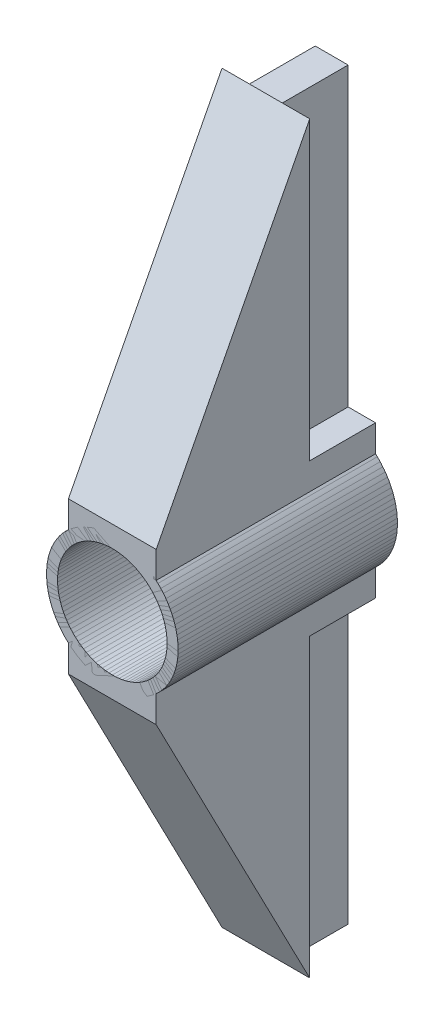
from build123d import *

# Parameters (mm, degrees)
SKETCH1_R             = 6
SKETCH1_R_2           = 5
BOSS_EXTRUDE1_DEPTH   = 20
BOSS_EXTRUDE2_DEPTH   = 4
SKETCH3_W             = 2.5
SKETCH3_H             = 6
CUT_EXTRUDE1_DEPTH    = 27.000002
BODY_MOVE_COPY1_ANGLE = 180
SKETCH4_R             = 5
CUT_EXTRUDE2_DEPTH    = 40.831531803


with BuildPart() as part:
    # Sketch1 → Boss-Extrude1 (new body)
    with BuildSketch(Plane.XY):
        Circle(SKETCH1_R)
        Circle(SKETCH1_R_2, mode=Mode.SUBTRACT)
    extrude(amount=BOSS_EXTRUDE1_DEPTH)

    # Sketch2 → Boss-Extrude2 (add, symmetric)
    with BuildSketch(Plane(origin=(0, 0, 0), x_dir=(0, 0, -1), z_dir=(1, 0, 0))):
        Polygon((-20, 6.9197719), (-20, 3.9197719), (0, 3.9197719), (0, 33.9197719), (-6, 33.9197719), align=None)
    extrude(amount=BOSS_EXTRUDE2_DEPTH, both=True)

    # Sketch3 → Cut-Extrude1 (cut)
    with BuildSketch(Plane(origin=(0, 33.9197719, 0), x_dir=(1, 0, 0), z_dir=(0, 1, 0))):
        with Locations((-2.75, -3)):
            Rectangle(SKETCH3_W, SKETCH3_H)
        with Locations((2.75, -3)):
            Rectangle(SKETCH3_W, SKETCH3_H)
    extrude(amount=-CUT_EXTRUDE1_DEPTH, mode=Mode.SUBTRACT)


with BuildPart() as body_2:
    # Body-Move/Copy1: copy of part
    add(part.part.rotate(Axis((0, 0, 0), (0, 0, 1)), BODY_MOVE_COPY1_ANGLE))


with BuildPart() as cut_extrude2_tool:
    # Sketch4 → Cut-Extrude2 (new, through all)
    with BuildSketch(Plane(origin=(0, 0, 0), x_dir=(-1, 0, 0), z_dir=(0, 0, -1))):
        Circle(SKETCH4_R)
    extrude(amount=-CUT_EXTRUDE2_DEPTH)


with BuildPart() as part_1:
    add(part.part)

    # Cut-Extrude2: cut by cut_extrude2_tool
    add(cut_extrude2_tool.part, mode=Mode.SUBTRACT)


with BuildPart() as body_2_1:
    add(body_2.part)

    # Cut-Extrude2: cut by cut_extrude2_tool
    add(cut_extrude2_tool.part, mode=Mode.SUBTRACT)


solid = Compound([part_1.part, body_2_1.part])
